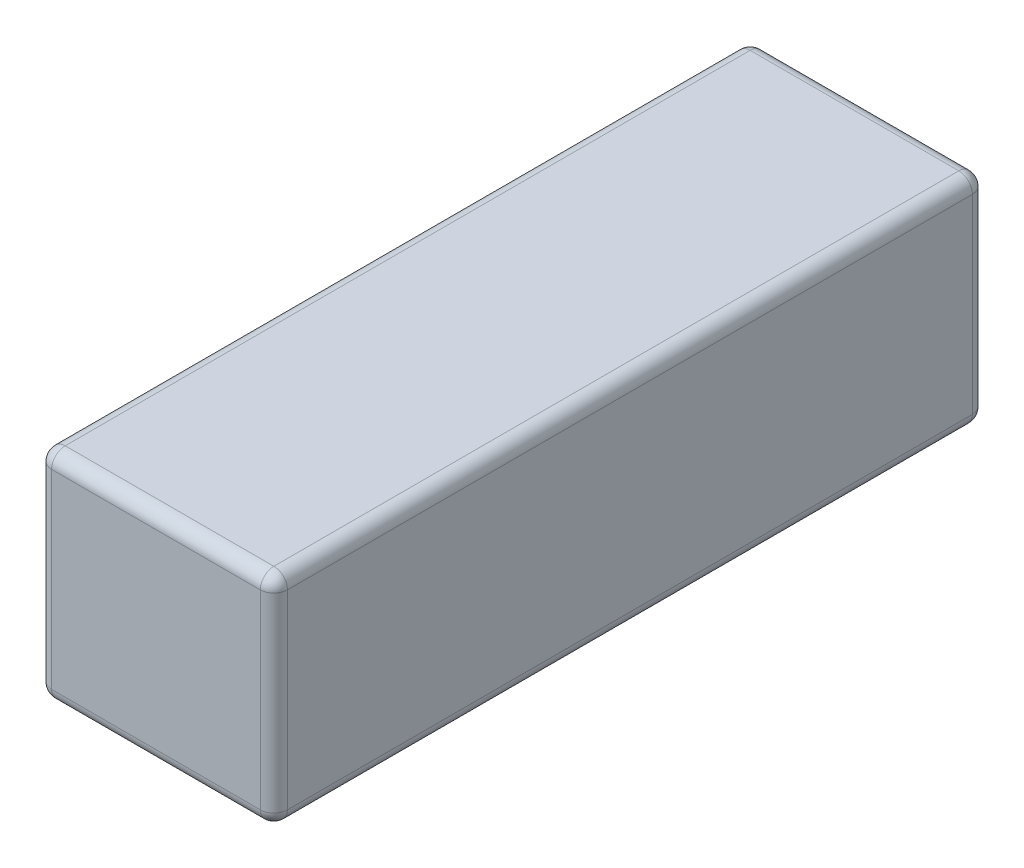
from build123d import *

# Parameters (mm, degrees)
SKETCH1_W           = 52
SKETCH1_H           = 48
BOSS_EXTRUDE1_DEPTH = 157
FILLET1_R           = 3


with BuildPart() as part:
    # Sketch1 → Boss-Extrude1 (new body)
    with BuildSketch(Plane.XY):
        with Locations((26, 24)):
            Rectangle(SKETCH1_W, SKETCH1_H)
    extrude(amount=BOSS_EXTRUDE1_DEPTH)

    # Fillet1
    fillet1_edges = [part.edges().sort_by_distance(p)[0] for p in [
        (52, 24, 157),
        (26, 48, 157),
        (0, 24, 157),
        (26, 48, 0),
        (52, 24, 0),
        (26, 0, 0),
        (0, 24, 0),
        (0, 48, 78.5),
        (52, 48, 78.5),
        (52, 0, 78.5),
        (0, 0, 78.5),
        (26, 0, 157),
    ]]
    fillet(fillet1_edges, radius=FILLET1_R)


solid = part.part
